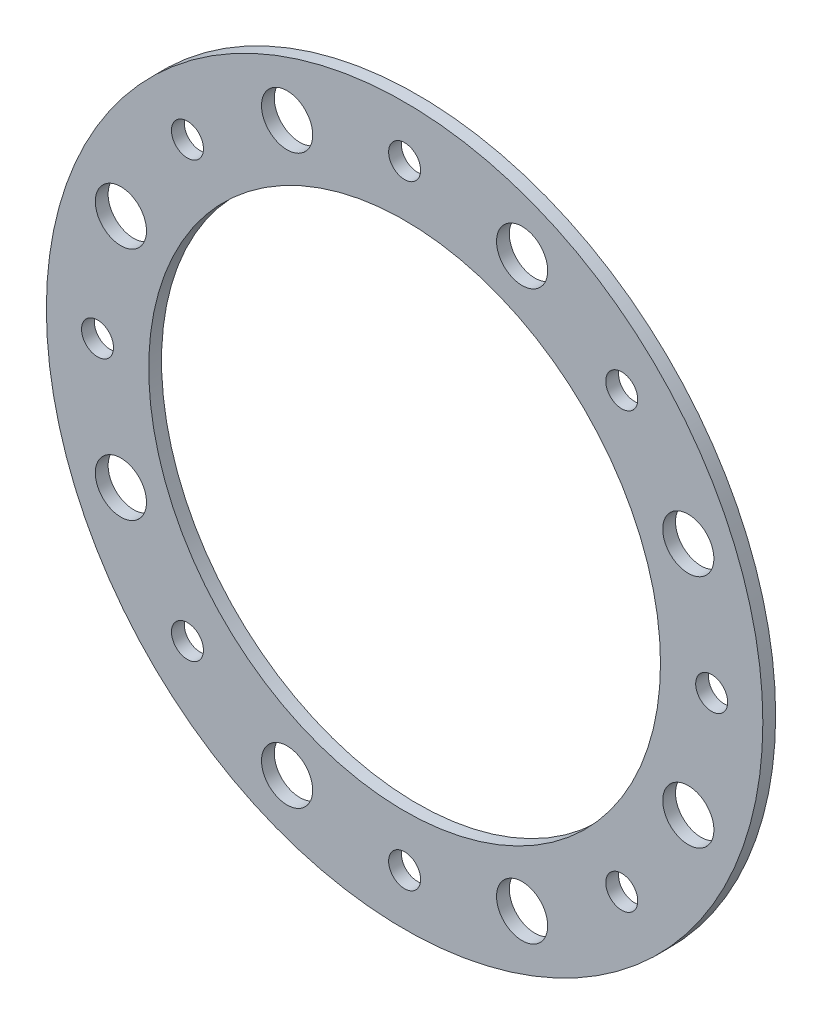
from build123d import *

# Parameters (mm, degrees)
SKETCH1_R           = 28
SKETCH1_R_2         = 20
BOSS_EXTRUDE1_DEPTH = 1
CIRPATTERN1_COUNT   = 8
CIRPATTERN2_COUNT   = 8


with BuildPart() as part:
    # Sketch1 → Boss-Extrude1 (new body)
    with BuildSketch(Plane.XY):
        Circle(SKETCH1_R)
        Circle(SKETCH1_R_2, mode=Mode.SUBTRACT)
    extrude(amount=BOSS_EXTRUDE1_DEPTH)

    # Sketch2 → Ø2.5 (2.5) Diameter Hole1 (revolve, cut)
    with BuildSketch(Plane(origin=(0, 24, 1), x_dir=(0, -1, 0), z_dir=(1, 0, 0))):
        Polygon((0, 0), (0, 2.251075774), (1.25, 1.5), (1.25, 0), align=None)
    f_2_5_2_5_diameter_hole1 = revolve(axis=Axis((0, 24, 7.35), (0, 0, -1)), mode=Mode.SUBTRACT)

    # CirPattern1: Ø2.5 (2.5) Diameter Hole1 ×8 about axis
    cirpattern1_axis = Axis((0, 0, -0.0127), (0, 0, -1))
    for i in range(1, CIRPATTERN1_COUNT):
        add(f_2_5_2_5_diameter_hole1.rotate(cirpattern1_axis, i * 360 / CIRPATTERN1_COUNT), mode=Mode.SUBTRACT)

    # Sketch4 → Ø4.0 (4) Diameter Hole1 (revolve, cut)
    with BuildSketch(Plane(origin=(9.184402377, 22.17310878, 1), x_dir=(0, -1, 0), z_dir=(1, 0, 0))):
        Polygon((0, 0), (0, 2.701721238), (2, 1.5), (2, 0), align=None)
    f_4_0_4_diameter_hole1 = revolve(axis=Axis((9.184402377, 22.17310878, 7.35), (0, 0, -1)), mode=Mode.SUBTRACT)

    # CirPattern2: Ø4.0 (4) Diameter Hole1 ×8 about axis
    cirpattern2_axis = Axis((0, 0, -0.0127), (0, 0, -1))
    for i in range(1, CIRPATTERN2_COUNT):
        add(f_4_0_4_diameter_hole1.rotate(cirpattern2_axis, i * 360 / CIRPATTERN2_COUNT), mode=Mode.SUBTRACT)


solid = part.part
